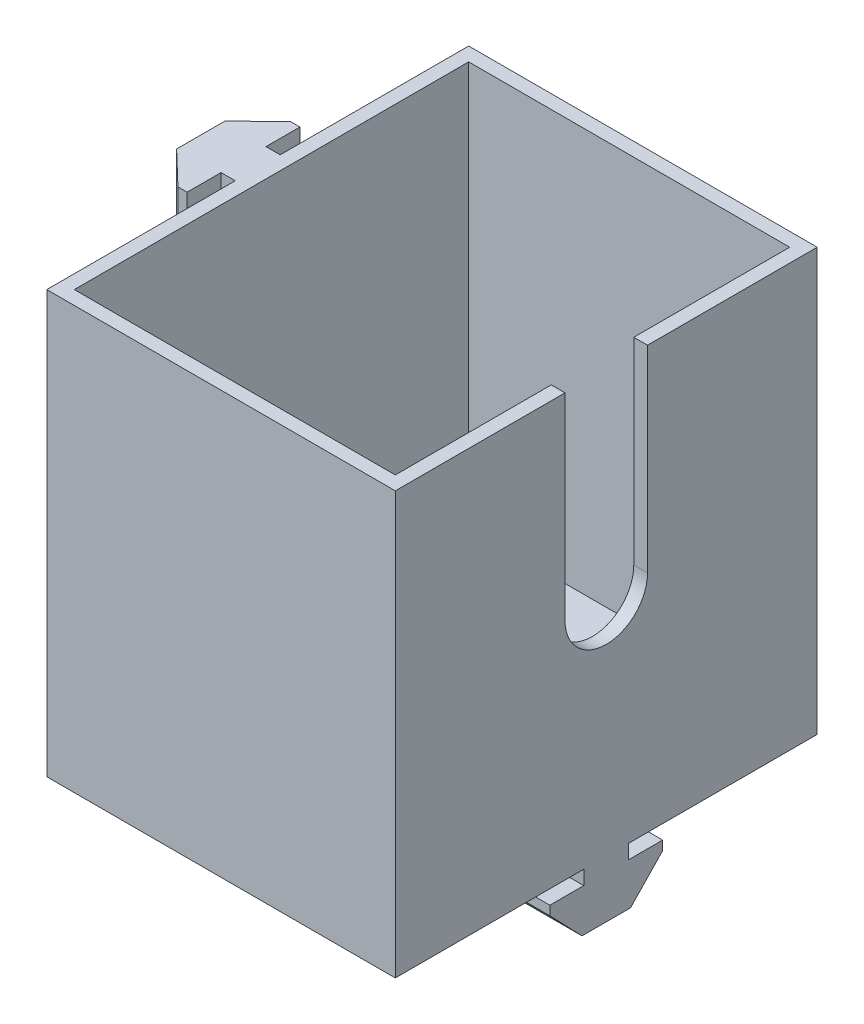
from build123d import *

# Parameters (mm, degrees)
ESQUISSE1_W                   = 44.2
ESQUISSE1_H                   = 52.2
BOSS_EXTRU_1_DEPTH            = 52.2
ENL_V_MAT_EXTRU_2_DEPTH       = 74.209903702
ENL_V_MAT_EXTRU_2_DEPTH_BACK  = 44.2
ENL_V_MAT_EXTRU_3_DEPTH       = 74.209903702
ENL_V_MAT_EXTRU_3_DEPTH_BACK  = 44.2
ENL_V_MAT_EXTRU_4_DEPTH       = 78.059003368
ENL_V_MAT_EXTRU_4_DEPTH_BACK  = 46
ENL_V_MAT_EXTRU_5_DEPTH       = 78.059003368
ENL_V_MAT_EXTRU_5_DEPTH_BACK  = 46
ENL_V_MAT_EXTRU_7_DEPTH       = 45.550224466
ENL_V_MAT_EXTRU_7_DEPTH_BACK  = 45.550224466
ENL_V_MAT_EXTRU_8_DEPTH       = 78.059003368
ENL_V_MAT_EXTRU_8_DEPTH_BACK  = 46
ENL_V_MAT_EXTRU_9_DEPTH       = 75.993733072
ENL_V_MAT_EXTRU_9_DEPTH_BACK  = 46
ESQUISSE13_W                  = 35
ESQUISSE13_H                  = 43
ENL_V_MAT_EXTRU_10_DEPTH      = 44
ENL_V_MAT_EXTRU_11_DEPTH      = 72.032809321
ENL_V_MAT_EXTRU_11_DEPTH_BACK = 1.5


with BuildPart() as part:
    # Esquisse1 → Boss.-Extru.1 (new body)
    with BuildSketch(Plane.XY):
        Rectangle(ESQUISSE1_W, ESQUISSE1_H)
    extrude(amount=BOSS_EXTRU_1_DEPTH)

    # Esquisse2 → Enlèv. mat.-Extru.2 (cut, two sides: drawn at the far end of the back side and taken through both)
    with BuildSketch(Plane(origin=(22.1, 0, 0), x_dir=(0, 0, -1), z_dir=(1, 0, 0)).offset(-ENL_V_MAT_EXTRU_2_DEPTH_BACK)):
        Polygon((-201.352290675, -19.9), (-52.2, -19.9), (-28.55, -19.9), (-28.55, -21.45), (-32.25, -21.45), (-32.25, -22.45), (-28.745559959, -26.1), (74.553898465, -133.690091099), (-39.180744024, -409.461834307), (-315.086933163, -295.671743208), align=None)
    extrude(amount=ENL_V_MAT_EXTRU_2_DEPTH + ENL_V_MAT_EXTRU_2_DEPTH_BACK, mode=Mode.SUBTRACT)

    # Esquisse3 → Enlèv. mat.-Extru.3 (cut, two sides: drawn at the far end of the back side and taken through both)
    with BuildSketch(Plane(origin=(22.1, 0, 0), x_dir=(0, 0, -1), z_dir=(1, 0, 0)).offset(-ENL_V_MAT_EXTRU_3_DEPTH_BACK)):
        Polygon((149.152290675, -19.9), (0, -19.9), (-23.65, -19.9), (-23.65, -21.45), (-19.95, -21.45), (-19.95, -22.45), (-23.454440041, -26.1), (-126.753898465, -133.690091099), (-13.019255976, -409.461834307), (262.886933163, -295.671743208), align=None)
    extrude(amount=ENL_V_MAT_EXTRU_3_DEPTH + ENL_V_MAT_EXTRU_3_DEPTH_BACK, mode=Mode.SUBTRACT)

    # Esquisse4 → Enlèv. mat.-Extru.4 (cut, two sides: drawn at the far end of the back side and taken through both)
    with BuildSketch(Plane(origin=(0, 26.1, 0), x_dir=(1, 0, 0), z_dir=(0, 1, 0)).offset(-ENL_V_MAT_EXTRU_4_DEPTH_BACK)):
        Polygon((-15.9, -191.333109619), (-15.9, -52.2), (-15.9, -28.55), (-17.45, -28.55), (-17.45, -32.25), (-18.45, -32.25), (-22.1, -28.745559959), (-122.462816227, 67.614843274), (-379.791464965, -38.281593439), (-273.228648738, -297.229546332), align=None)
    extrude(amount=ENL_V_MAT_EXTRU_4_DEPTH + ENL_V_MAT_EXTRU_4_DEPTH_BACK, mode=Mode.SUBTRACT)

    # Esquisse5 → Enlèv. mat.-Extru.5 (cut, two sides: drawn at the far end of the back side and taken through both)
    with BuildSketch(Plane(origin=(0, 26.1, 0), x_dir=(1, 0, 0), z_dir=(0, 1, 0)).offset(-ENL_V_MAT_EXTRU_5_DEPTH_BACK)):
        Polygon((-15.9, 139.133109619), (-15.9, 0), (-15.9, -23.65), (-17.45, -23.65), (-17.45, -19.95), (-18.45, -19.95), (-22.1, -23.454440041), (-122.462816228, -119.814843274), (-379.791464965, -13.918406561), (-273.228648738, 245.029546332), align=None)
    extrude(amount=ENL_V_MAT_EXTRU_5_DEPTH + ENL_V_MAT_EXTRU_5_DEPTH_BACK, mode=Mode.SUBTRACT)

    # Esquisse6 → Enlèv. mat.-Extru.7 (cut, two sides: drawn at the far end of the back side and taken through both)
    with BuildSketch(Plane.XY.offset(28.55).offset(-ENL_V_MAT_EXTRU_7_DEPTH_BACK)):
        Polygon((-161.22284167, -19.9), (-22.1, -19.9), (-15.9, -19.9), (-15.9, -26.093649616), (-15.9, -165.216491285), (-212.645110561, -361.97019968), (-357.967952231, -216.653708395), align=None)
    extrude(amount=ENL_V_MAT_EXTRU_7_DEPTH + ENL_V_MAT_EXTRU_7_DEPTH_BACK, mode=Mode.SUBTRACT)

    # Esquisse11 → Enlèv. mat.-Extru.8 (cut, two sides: drawn at the far end of the back side and taken through both)
    with BuildSketch(Plane(origin=(0, 26.1, 0), x_dir=(1, 0, 0), z_dir=(0, 1, 0)).offset(-ENL_V_MAT_EXTRU_8_DEPTH_BACK)):
        Polygon((164.227968273, -49.1), (22.1, -49.1), (-15.9, -49.1), (-158.027968273, -49.1), (-158.027968273, -333.355936546), (164.227968273, -333.355936546), align=None)
    extrude(amount=ENL_V_MAT_EXTRU_8_DEPTH + ENL_V_MAT_EXTRU_8_DEPTH_BACK, mode=Mode.SUBTRACT)

    # Esquisse12 → Enlèv. mat.-Extru.9 (cut, two sides: drawn at the far end of the back side and taken through both)
    with BuildSketch(Plane(origin=(0, 26.1, 0), x_dir=(1, 0, 0), z_dir=(0, 1, 0)).offset(-ENL_V_MAT_EXTRU_9_DEPTH_BACK)):
        Polygon((159.687460199, -3.1), (22.1, -3.1), (-15.9, -3.1), (-153.487460199, -3.1), (-153.487460199, 272.074920398), (159.687460199, 272.074920398), align=None)
    extrude(amount=ENL_V_MAT_EXTRU_9_DEPTH + ENL_V_MAT_EXTRU_9_DEPTH_BACK, mode=Mode.SUBTRACT)

    # Esquisse13 → Enlèv. mat.-Extru.10 (cut)
    with BuildSketch(Plane(origin=(0, 26.1, 0), x_dir=(1, 0, 0), z_dir=(0, 1, 0))):
        with Locations((3.1, -26.1)):
            Rectangle(ESQUISSE13_W, ESQUISSE13_H)
    extrude(amount=-ENL_V_MAT_EXTRU_10_DEPTH, mode=Mode.SUBTRACT)

    # Esquisse14 → Enlèv. mat.-Extru.11 (cut, two sides: drawn at the far end of the back side and taken through both)
    with BuildSketch(Plane(origin=(22.1, 0, 0), x_dir=(0, 0, -1), z_dir=(1, 0, 0)).offset(-ENL_V_MAT_EXTRU_11_DEPTH_BACK)):
        with BuildLine():
            Line((-21.6, 4.6), (-21.6, 26.1))
            Line((-21.6, 26.1), (-30.6, 26.1))
            Line((-30.6, 26.1), (-30.6, 4.6))
            ThreePointArc((-30.6, 4.6), (-26.1, 0.1), (-21.6, 4.6))
        make_face()
    extrude(amount=ENL_V_MAT_EXTRU_11_DEPTH + ENL_V_MAT_EXTRU_11_DEPTH_BACK, mode=Mode.SUBTRACT)


solid = part.part
